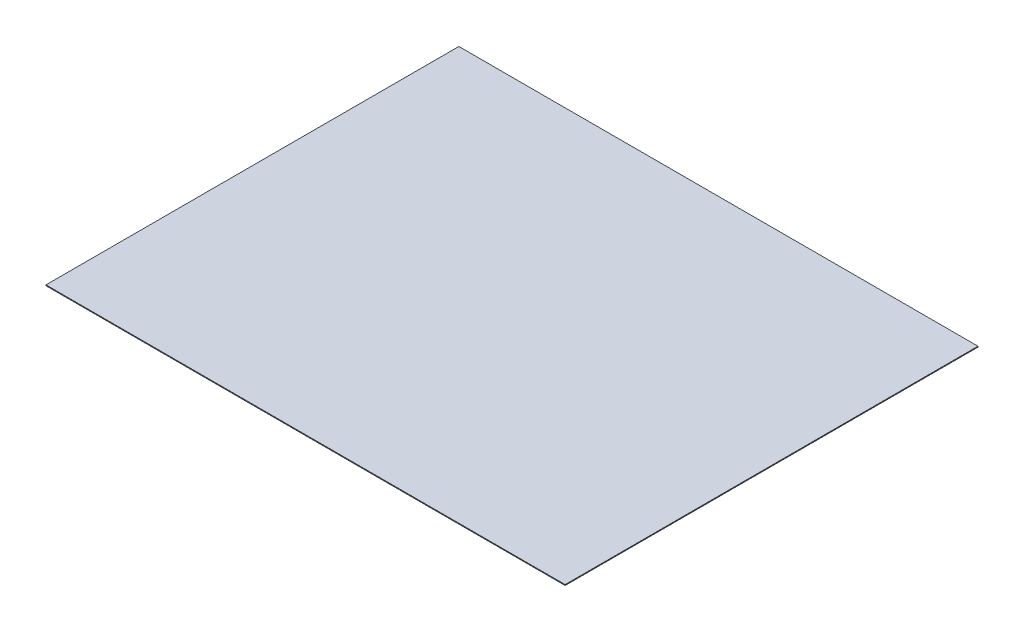
from build123d import *

# Parameters (mm, degrees)
SKETCH_1_W      = 127
SKETCH_1_H      = 101
EXTRUDE_1_DEPTH = 0.2


with BuildPart() as part:
    # Эскиз1 → Бобышка-Вытянуть1 (new body)
    with BuildSketch(Plane(origin=(0, 0, 0), x_dir=(1, 0, 0), z_dir=(0, 1, 0))):
        with Locations((63.5, -50.5)):
            Rectangle(SKETCH_1_W, SKETCH_1_H)
    extrude(amount=EXTRUDE_1_DEPTH)


solid = part.part
